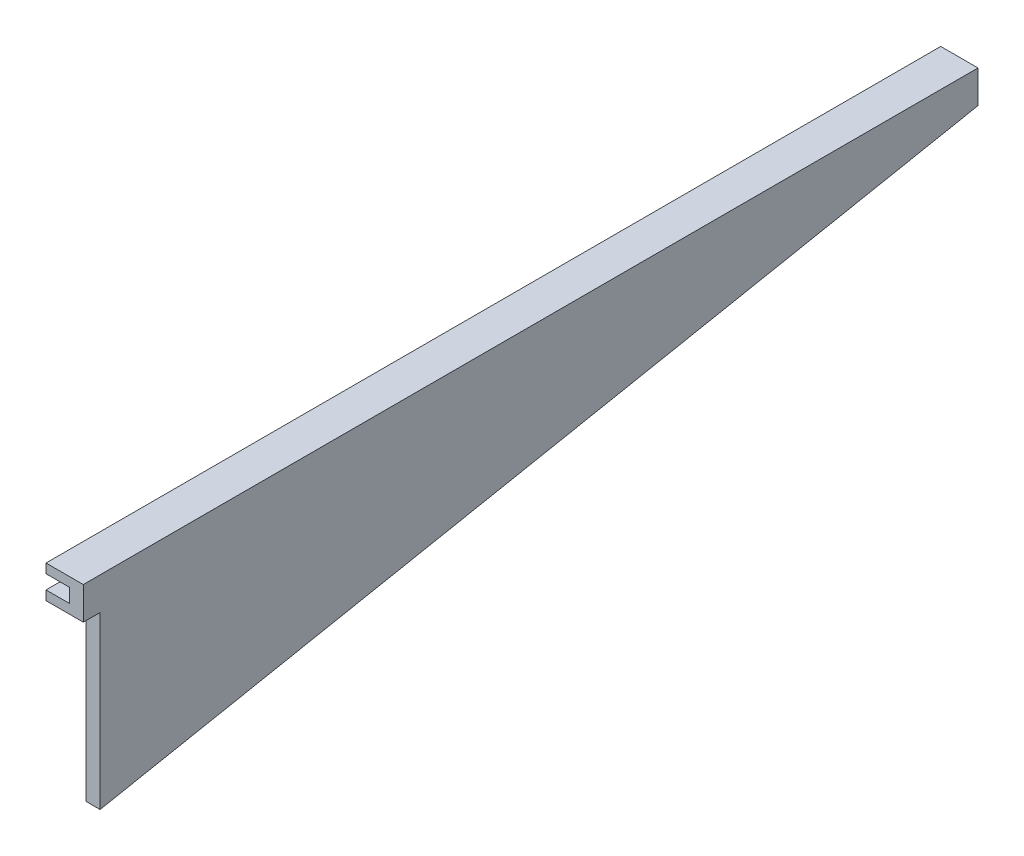
from build123d import *

# Parameters (mm, degrees)
SKETCH1_W                = 8
SKETCH1_H                = 7
BOSS_EXTRUDE1_DEPTH      = 192
SKETCH2_W                = 5
SKETCH2_H                = 3
CUT_EXTRUDE1_DEPTH       = 192
BOSS_EXTRUDE2_DEPTH      = 0.001
BOSS_EXTRUDE2_DEPTH_BACK = 3


with BuildPart() as part:
    # Sketch1 → Boss-Extrude1 (new body)
    with BuildSketch(Plane.XY):
        Rectangle(SKETCH1_W, SKETCH1_H)
    extrude(amount=BOSS_EXTRUDE1_DEPTH)

    # Sketch2 → Cut-Extrude1 (cut)
    with BuildSketch(Plane.XY.offset(192)):
        with Locations((-1.5, 0)):
            Rectangle(SKETCH2_W, SKETCH2_H)
    extrude(amount=-CUT_EXTRUDE1_DEPTH, mode=Mode.SUBTRACT)

    # Sketch3 → Boss-Extrude2 (add, two sides: drawn at the far end of the back side and taken through both)
    with BuildSketch(Plane(origin=(4, 0, 0), x_dir=(0, 0, -1), z_dir=(1, 0, 0)).offset(-BOSS_EXTRUDE2_DEPTH_BACK)):
        Polygon((0, -3.5), (-188.401251416, -40.121493492), (-188.401251416, -3.5), (-192, -3.5), (-192, 3.5), (0, 3.5), align=None)
    extrude(amount=BOSS_EXTRUDE2_DEPTH + BOSS_EXTRUDE2_DEPTH_BACK)


solid = part.part
